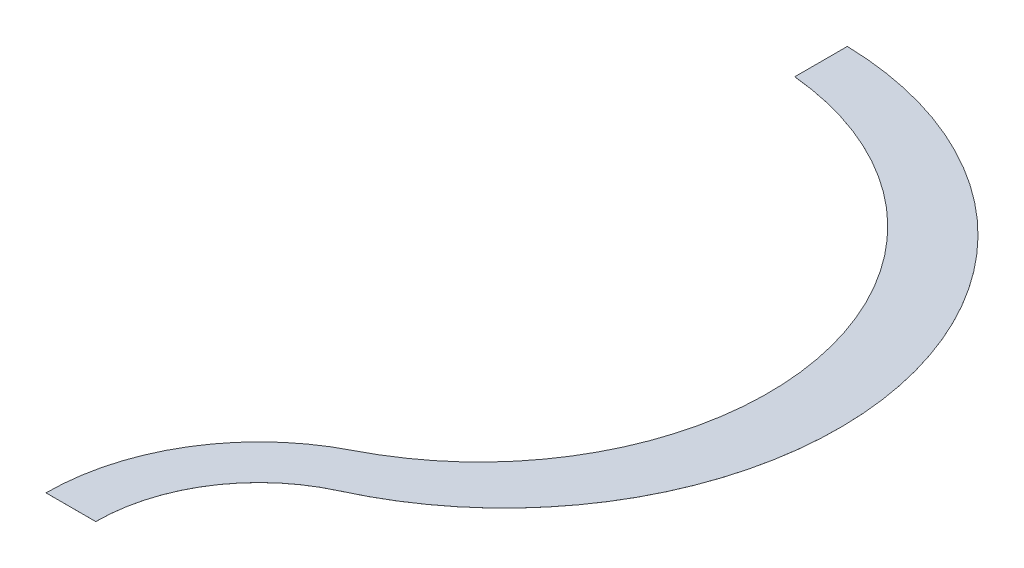
from build123d import *

# Parameters (mm, degrees)
RESSALTO_EXTRUS_O10_DEPTH = 0.01


with BuildPart() as part:
    # Esboço1 → Ressalto-extrusão10 (new body)
    with BuildSketch(Plane(origin=(0, 0, 0), x_dir=(1, 0, 0), z_dir=(0, 1, 0))):
        with BuildLine():
            Line((297.666961951, 791.249979553), (316.601353193, 791.249979553))
            ThreePointArc((316.601353193, 791.249979553), (326.459664642, 824.831536178), (352.905895622, 847.755412747))
            ThreePointArc((352.905895622, 847.755412747), (424.73842096, 989.200052783), (303.015592938, 1090.935253327))
            Line((303.015592938, 1090.935253327), (303.015592938, 1070.935253327))
            ThreePointArc((303.015592938, 1070.935253327), (400.339583638, 981.95381865), (342.105865492, 863.638608496))
            ThreePointArc((342.105865492, 863.638608496), (309.663048344, 833.720350837), (297.666961951, 791.249979553))
        make_face()
    extrude(amount=RESSALTO_EXTRUS_O10_DEPTH)


solid = part.part
